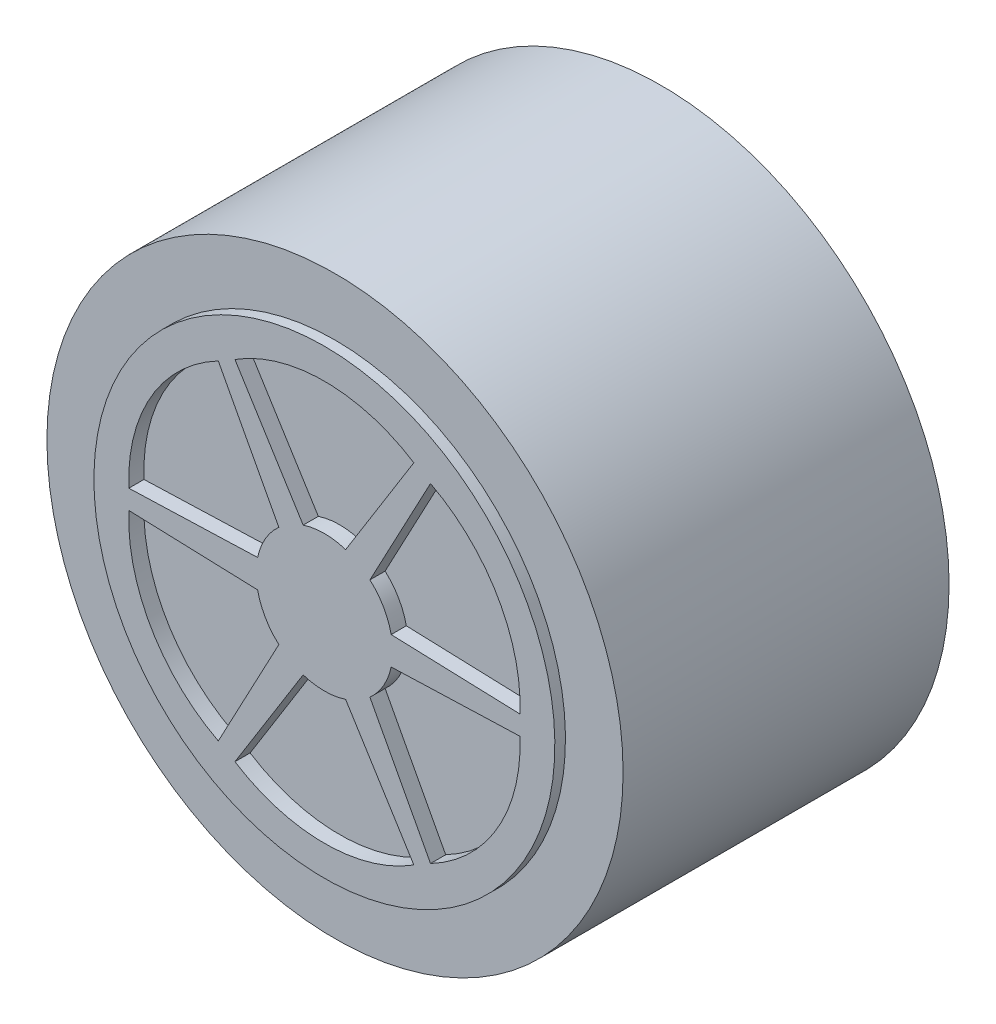
from build123d import *

# Parameters (mm, degrees)
CORTAR_EXTRUIR4_DEPTH      = 1
CROQUIS7_R                 = 7.5
CORTAR_EXTRUIR5_DEPTH      = 9
CORTAR_EXTRUIR6_DEPTH      = 9
CORTAR_EXTRUIR8_DEPTH      = 5
CORTAR_EXTRUIR8_DEPTH_BACK = 35.470929781
CROQUIS10_R                = 3
CROQUIS11_R                = 1.5
CORTAR_EXTRUIR9_DEPTH      = 5.2
CROQUIS12_W                = 21.5
CROQUIS12_H                = 4.5


with BuildPart() as part:
    # Croquis1 → Revolución1 (revolve)
    with BuildSketch(Plane(origin=(0, 0, 0), x_dir=(0, 0, -1), z_dir=(1, 0, 0))):
        Polygon((0, 0), (6.15, 0), (6.15, 14.5), (-15.35, 14.5), (-15.35, 15.2), (-16.05, 15.2), (-16.05, 0), align=None)
    revolve(axis=Axis((0, 0, 0), (0, 0, 1)))

    # Croquis5 → Cortar-Extruir4 (cut)
    with BuildSketch(Plane.XY.offset(16.05)):
        with BuildLine():
            ThreePointArc((-1.4, 4.276680956), (0, 4.5), (1.4, 4.276680956))
            Line((1.4, 4.276680956), (5.9, 11.487783507))
            ThreePointArc((5.9, 11.487783507), (0, 13.2), (-5.9, 11.487783507))
            Line((-5.9, 11.487783507), (-1.4, 4.276680956))
        make_face()
        with BuildLine():
            Line((6.99871235, 10.853441636), (3.003714352, 3.350776043))
            ThreePointArc((3.003714352, 3.350776043), (3.897114317, 2.25), (4.403714352, 0.925904913))
            Line((4.403714352, 0.925904913), (12.89871235, 0.634341871))
            ThreePointArc((12.89871235, 0.634341871), (11.43153533, 6.6), (6.99871235, 10.853441636))
        make_face()
        with BuildLine():
            Line((12.89871235, -0.634341871), (4.403714352, -0.925904913))
            ThreePointArc((4.403714352, -0.925904913), (3.897114317, -2.25), (3.003714352, -3.350776043))
            Line((3.003714352, -3.350776043), (6.99871235, -10.853441636))
            ThreePointArc((6.99871235, -10.853441636), (11.43153533, -6.6), (12.89871235, -0.634341871))
        make_face()
        with BuildLine():
            Line((5.9, -11.487783507), (1.4, -4.276680956))
            ThreePointArc((1.4, -4.276680956), (0, -4.5), (-1.4, -4.276680956))
            Line((-1.4, -4.276680956), (-5.9, -11.487783507))
            ThreePointArc((-5.9, -11.487783507), (0, -13.2), (5.9, -11.487783507))
        make_face()
        with BuildLine():
            ThreePointArc((-3.003714352, -3.350776043), (-3.897114317, -2.25), (-4.403714352, -0.925904913))
            Line((-4.403714352, -0.925904913), (-12.89871235, -0.634341871))
            ThreePointArc((-12.89871235, -0.634341871), (-11.43153533, -6.6), (-6.99871235, -10.853441636))
            Line((-6.99871235, -10.853441636), (-3.003714352, -3.350776043))
        make_face()
        with BuildLine():
            ThreePointArc((-4.403714352, 0.925904913), (-3.897114317, 2.25), (-3.003714352, 3.350776043))
            Line((-3.003714352, 3.350776043), (-6.99871235, 10.853441636))
            ThreePointArc((-6.99871235, 10.853441636), (-11.43153533, 6.6), (-12.89871235, 0.634341871))
            Line((-12.89871235, 0.634341871), (-4.403714352, 0.925904913))
        make_face()
    extrude(amount=-CORTAR_EXTRUIR4_DEPTH, mode=Mode.SUBTRACT)

    # Croquis7 → Cortar-Extruir5 (cut)
    with BuildSketch(Plane(origin=(0, 0, -6.15), x_dir=(-1, 0, 0), z_dir=(0, 0, -1))):
        with Locations(Location((0, 0, 0), (0, 0, 90))):
            Circle(CROQUIS7_R)
    extrude(amount=-CORTAR_EXTRUIR5_DEPTH, mode=Mode.SUBTRACT)

    # Croquis8 → Cortar-Extruir6 (cut)
    with BuildSketch(Plane(origin=(0, 0, 2.85), x_dir=(-1, 0, 0), z_dir=(0, 0, -1))):
        with BuildLine():
            Line((-1.140175425, -1.05), (1.140175425, -1.05))
            ThreePointArc((1.140175425, -1.05), (0, 1.55), (-1.140175425, -1.05))
        make_face()
    extrude(amount=-CORTAR_EXTRUIR6_DEPTH, mode=Mode.SUBTRACT)

    # Croquis10 → Cortar-Extruir8 (cut, two sides: drawn at the far end of the back side and taken through both)
    with BuildSketch(Plane(origin=(0, -11.25, 0), x_dir=(1, 0, 0), z_dir=(0, 1, 0)).offset(-CORTAR_EXTRUIR8_DEPTH_BACK)):
        with Locations(Location((0, -8.85, 0), (0, 0, 270))):
            Circle(CROQUIS10_R)
    extrude(amount=CORTAR_EXTRUIR8_DEPTH + CORTAR_EXTRUIR8_DEPTH_BACK, mode=Mode.SUBTRACT)

    # Croquis11 → Cortar-Extruir9 (cut)
    with BuildSketch(Plane.XZ.offset(6.25)):
        with Locations(Location((0, 8.85, 0), (0, 0, 270))):
            Circle(CROQUIS11_R)
    extrude(amount=-CORTAR_EXTRUIR9_DEPTH, mode=Mode.SUBTRACT)

    # Croquis12 → Revolución2 (revolve)
    with BuildSketch(Plane(origin=(0, 0, 0), x_dir=(0, 0, -1), z_dir=(1, 0, 0)), mode=Mode.PRIVATE) as revoluci_n2_sk:
        with Locations((-4.6, 16.75)):
            Rectangle(CROQUIS12_W, CROQUIS12_H)
    revolve(revoluci_n2_sk.sketch.rotate(Axis((0, 0, 12.043120257), (0, 0, -1)), 90), axis=Axis((0, 0, 12.043120257), (0, 0, -1)))


solid = part.part
